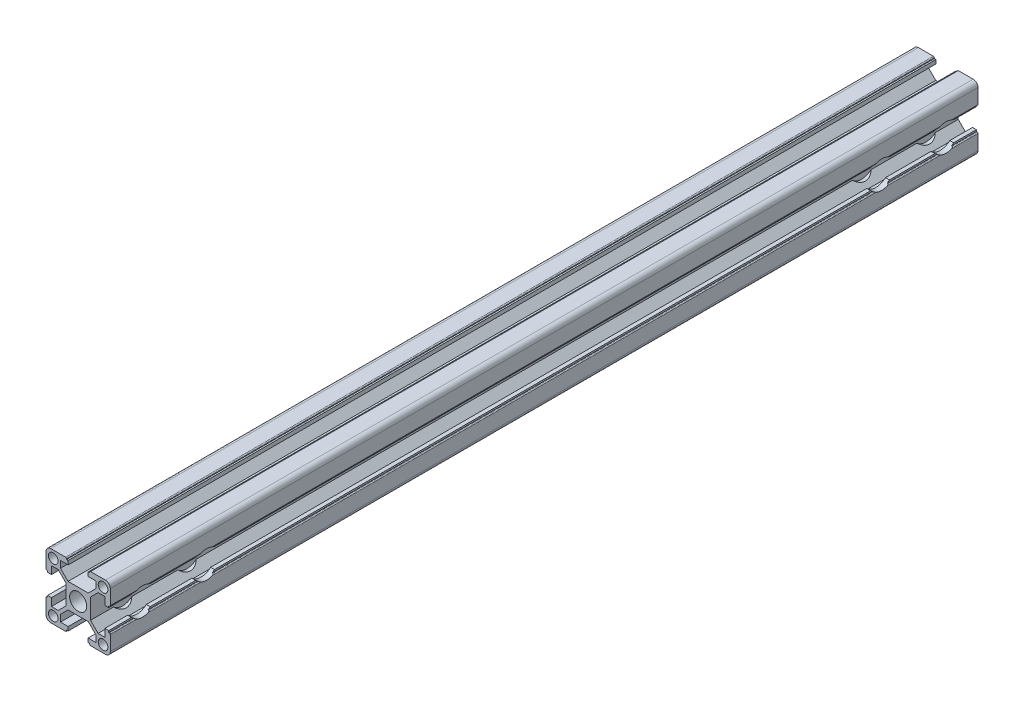
from build123d import *

# Parameters (mm, degrees)
SKETCH_1_R          = 2.65
SKETCH_1_R_2        = 1.5
EXTRUDE_1_DEPTH     = 135
SKETCH_4_R          = 2
CUT_EXTRUDE_3_DEPTH = 137.076531775
SKETCH_5_R          = 4.25
CUT_EXTRUDE_4_DEPTH = 137.076531875


with BuildPart() as part:
    # 草图1 → 凸台-拉伸1 (new, symmetric)
    with BuildSketch(Plane.XY):
        with BuildLine():
            Line((3.142893219, 3.85), (-3.142893219, 3.85))
            Line((-3.142893219, 3.85), (-5.5, 6.207106781))
            Line((-5.5, 6.207106781), (-5.5, 8.3))
            Line((-5.5, 8.3), (-3.1, 8.3))
            Line((-3.1, 8.3), (-3.1, 9.5))
            Line((-3.1, 9.5), (-3.6, 9.5))
            Line((-3.6, 9.5), (-3.6, 9.7))
            ThreePointArc((-3.6, 9.7), (-3.687867966, 9.912132034), (-3.9, 10))
            Line((-3.9, 10), (-8.5, 10))
            ThreePointArc((-8.5, 10), (-9.560660172, 9.560660172), (-10, 8.5))
            Line((-10, 8.5), (-10, 3.9))
            ThreePointArc((-10, 3.9), (-9.912132034, 3.687867966), (-9.7, 3.6))
            Line((-9.7, 3.6), (-9.5, 3.6))
            Line((-9.5, 3.6), (-9.5, 3.1))
            Line((-9.5, 3.1), (-8.3, 3.1))
            Line((-8.3, 3.1), (-8.3, 5.5))
            Line((-8.3, 5.5), (-6.207106781, 5.5))
            Line((-6.207106781, 5.5), (-3.85, 3.142893219))
            Line((-3.85, 3.142893219), (-3.85, -3.142893219))
            Line((-3.85, -3.142893219), (-6.207106781, -5.5))
            Line((-6.207106781, -5.5), (-8.3, -5.5))
            Line((-8.3, -5.5), (-8.3, -3.1))
            Line((-8.3, -3.1), (-9.5, -3.1))
            Line((-9.5, -3.1), (-9.5, -3.6))
            Line((-9.5, -3.6), (-9.7, -3.6))
            ThreePointArc((-9.7, -3.6), (-9.912132034, -3.687867966), (-10, -3.9))
            Line((-10, -3.9), (-10, -8.5))
            ThreePointArc((-10, -8.5), (-9.560660172, -9.560660172), (-8.5, -10))
            Line((-8.5, -10), (-3.9, -10))
            ThreePointArc((-3.9, -10), (-3.687867966, -9.912132034), (-3.6, -9.7))
            Line((-3.6, -9.7), (-3.6, -9.5))
            Line((-3.6, -9.5), (-3.1, -9.5))
            Line((-3.1, -9.5), (-3.1, -8.3))
            Line((-3.1, -8.3), (-5.5, -8.3))
            Line((-5.5, -8.3), (-5.5, -6.207106781))
            Line((-5.5, -6.207106781), (-3.142893219, -3.85))
            Line((-3.142893219, -3.85), (3.142893219, -3.85))
            Line((3.142893219, -3.85), (5.5, -6.207106781))
            Line((5.5, -6.207106781), (5.5, -8.3))
            Line((5.5, -8.3), (3.1, -8.3))
            Line((3.1, -8.3), (3.1, -9.5))
            Line((3.1, -9.5), (3.6, -9.5))
            Line((3.6, -9.5), (3.6, -9.7))
            ThreePointArc((3.6, -9.7), (3.687867966, -9.912132034), (3.9, -10))
            Line((3.9, -10), (8.5, -10))
            ThreePointArc((8.5, -10), (9.560660172, -9.560660172), (10, -8.5))
            Line((10, -8.5), (10, -3.9))
            ThreePointArc((10, -3.9), (9.912132034, -3.687867966), (9.7, -3.6))
            Line((9.7, -3.6), (9.5, -3.6))
            Line((9.5, -3.6), (9.5, -3.1))
            Line((9.5, -3.1), (8.3, -3.1))
            Line((8.3, -3.1), (8.3, -5.5))
            Line((8.3, -5.5), (6.207106781, -5.5))
            Line((6.207106781, -5.5), (3.85, -3.142893219))
            Line((3.85, -3.142893219), (3.85, 3.142893219))
            Line((3.85, 3.142893219), (6.207106781, 5.5))
            Line((6.207106781, 5.5), (8.3, 5.5))
            Line((8.3, 5.5), (8.3, 3.1))
            Line((8.3, 3.1), (9.5, 3.1))
            Line((9.5, 3.1), (9.5, 3.6))
            Line((9.5, 3.6), (9.7, 3.6))
            ThreePointArc((9.7, 3.6), (9.912132034, 3.687867966), (10, 3.9))
            Line((10, 3.9), (10, 8.5))
            ThreePointArc((10, 8.5), (9.560660172, 9.560660172), (8.5, 10))
            Line((8.5, 10), (3.9, 10))
            ThreePointArc((3.9, 10), (3.687867966, 9.912132034), (3.6, 9.7))
            Line((3.6, 9.7), (3.6, 9.5))
            Line((3.6, 9.5), (3.1, 9.5))
            Line((3.1, 9.5), (3.1, 8.3))
            Line((3.1, 8.3), (5.5, 8.3))
            Line((5.5, 8.3), (5.5, 6.207106781))
            Line((5.5, 6.207106781), (3.142893219, 3.85))
        make_face()
        Circle(SKETCH_1_R, mode=Mode.SUBTRACT)
        with Locations((-7.75, 7.75)):
            Circle(SKETCH_1_R_2, mode=Mode.SUBTRACT)
        with Locations((7.75, 7.75)):
            Circle(SKETCH_1_R_2, mode=Mode.SUBTRACT)
        with Locations((7.75, -7.75)):
            Circle(SKETCH_1_R_2, mode=Mode.SUBTRACT)
        with Locations((-7.75, -7.75)):
            Circle(SKETCH_1_R_2, mode=Mode.SUBTRACT)
    extrude(amount=EXTRUDE_1_DEPTH, both=True)

    # 草图4 → 切除-拉伸3 (cut, through all)
    with BuildSketch(Plane(origin=(3.85, 0, 0), x_dir=(0, 0, -1), z_dir=(1, 0, 0))):
        with Locations((-125, 0)):
            Circle(SKETCH_4_R)
        with Locations((125, 0)):
            Circle(SKETCH_4_R)
        with Locations((-105, 0)):
            Circle(SKETCH_4_R)
        with Locations((105, 0)):
            Circle(SKETCH_4_R)
    extrude(amount=-CUT_EXTRUDE_3_DEPTH, mode=Mode.SUBTRACT)

    # 草图5 → 切除-拉伸4 (cut, through all)
    with BuildSketch(Plane(origin=(3.85, 0, 0), x_dir=(0, 0, -1), z_dir=(1, 0, 0))):
        with Locations((-125, 0)):
            Circle(SKETCH_5_R)
        with Locations((-105, 0)):
            Circle(SKETCH_5_R)
        with Locations((105, 0)):
            Circle(SKETCH_5_R)
        with Locations((125, 0)):
            Circle(SKETCH_5_R)
    extrude(amount=CUT_EXTRUDE_4_DEPTH, mode=Mode.SUBTRACT)


solid = part.part
